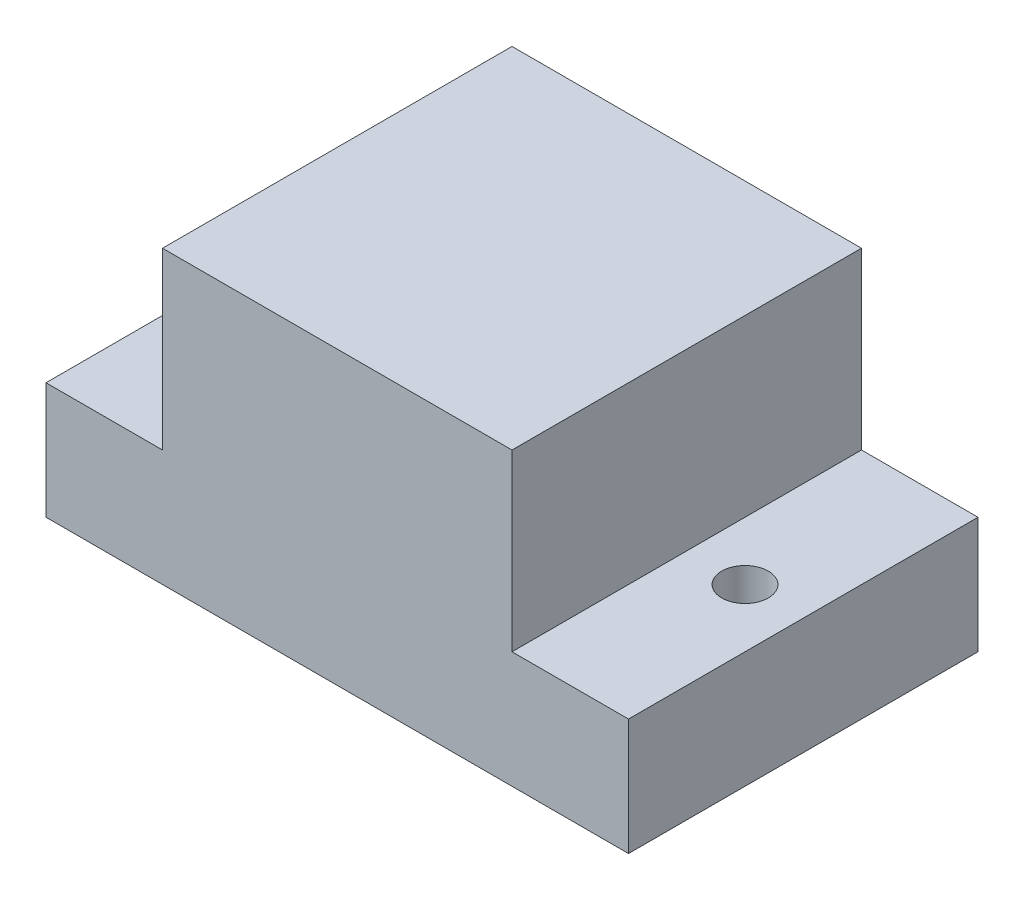
from build123d import *

# Parameters (mm, degrees)
CROQUIS1_W              = 10
CROQUIS1_H              = 10
CROQUIS1_W_2            = 30
CROQUIS1_H_2            = 25
SALIENTE_EXTRUIR1_DEPTH = 15
CROQUIS2_R              = 2
CORTAR_EXTRUIR1_DEPTH   = 30


with BuildPart() as part:
    # Croquis1 → Saliente-Extruir1 (new, symmetric)
    with BuildSketch(Plane.XY):
        with Locations((-20, -7.5)):
            Rectangle(CROQUIS1_W, CROQUIS1_H)
        Rectangle(CROQUIS1_W_2, CROQUIS1_H_2)
        with Locations((20, -7.5)):
            Rectangle(CROQUIS1_W, CROQUIS1_H)
    extrude(amount=SALIENTE_EXTRUIR1_DEPTH, both=True)

    # Croquis2 → Cortar-Extruir1 (cut)
    with BuildSketch(Plane(origin=(0, -2.5, 0), x_dir=(1, 0, 0), z_dir=(0, 1, 0))):
        with Locations(Location((-20, 0, 0), (0, 0, 180))):
            Circle(CROQUIS2_R)
        with Locations((20, 0)):
            Circle(CROQUIS2_R)
    extrude(amount=-CORTAR_EXTRUIR1_DEPTH, mode=Mode.SUBTRACT)


solid = part.part
